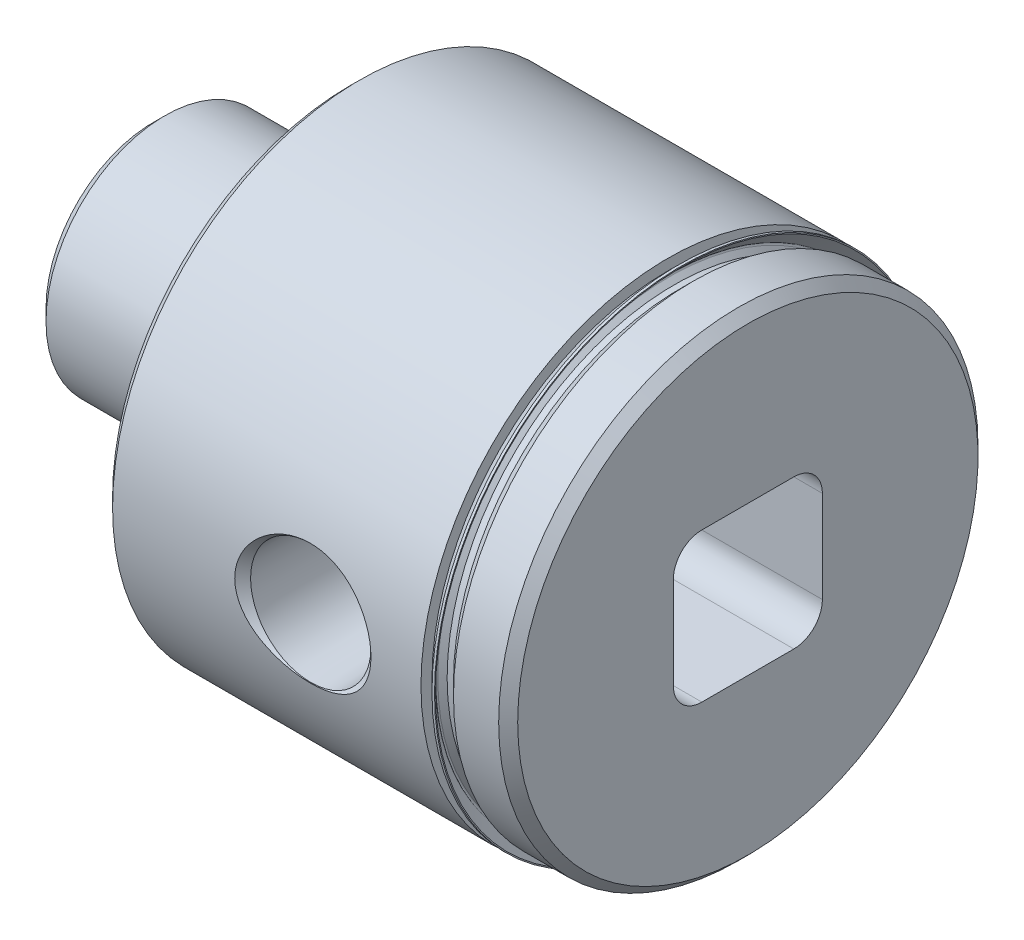
from build123d import *

# Parameters (mm, degrees)
CUT_EXTRUDE1_DEPTH = 95.25


with BuildPart() as part:
    # Sketch1 → Revolve1 (revolve)
    with BuildSketch(Plane.XY):
        with BuildLine():
            Line((0, 0), (0, 8.58901))
            Line((0, 8.58901), (0.93599, 9.525))
            Line((0.93599, 9.525), (9.344692072, 9.525))
            Line((9.344692072, 9.525), (10.348204118, 8.708440423))
            ThreePointArc((10.348204118, 8.708440423), (10.611556372, 8.560342712), (10.9093, 8.509))
            Line((10.9093, 8.509), (12.4714, 8.509))
            ThreePointArc((12.4714, 8.509), (13.100017928, 8.769382072), (13.3604, 9.398))
            Line((13.3604, 9.398), (13.3604, 9.49325))
            Line((13.3604, 9.49325), (15.748, 9.49325))
            Line((15.748, 9.49325), (15.748, 0))
            Line((15.748, 0), (0, 0))
        make_face()
    revolve(axis=Axis((15.748, 0, 0), (-1, 0, 0)))

    # Sketch2 → Revolve2 (revolve)
    with BuildSketch(Plane.XY):
        Polygon((15.748, 0), (15.748, 19.00555), (16.51, 19.76755), (41.2115, 19.76755), (41.2115, 18.18005), (42.2275, 18.18005), (43.2435, 19.19605), (46.863, 19.19605), (47.625, 18.43405), (47.625, 0), align=None)
    revolve(axis=Axis((47.625, 0, 0), (-1, 0, 0)))

    # Sketch3 → Cut-Revolve1 (revolve, cut)
    with BuildSketch(Plane(origin=(0, 0, 0), x_dir=(1, 0, 0), z_dir=(0, 1, 0))):
        Polygon((31.75, 0), (34.925, 0), (34.925, -8.330850926), (36.256425852, -9.09955), (36.569651116, -19.132537191), (37.204663925, -19.76755), (31.75, -19.76755), align=None)
    revolve(axis=Axis((31.75, 0, 19.76755), (0, 0, -1)), mode=Mode.SUBTRACT)

    # Sketch4 → Revolve3 (revolve)
    with BuildSketch(Plane.XY):
        with BuildLine():
            Line((41.2115, 17.92605), (42.2275, 17.92605))
            Line((42.2275, 17.92605), (42.2275, 18.18005))
            Line((42.2275, 18.18005), (41.7195, 18.18005))
            Line((41.7195, 18.18005), (41.344882072, 18.554667928))
            ThreePointArc((41.344882072, 18.554667928), (41.307684633, 18.64447049), (41.344882072, 18.734273051))
            Line((41.344882072, 18.734273051), (42.293990825, 19.683381804))
            Line((42.293990825, 19.683381804), (42.293990825, 19.76755))
            Line((42.293990825, 19.76755), (42.090790825, 19.76755))
            Line((42.090790825, 19.76755), (41.2115, 18.888259175))
            Line((41.2115, 18.888259175), (41.2115, 17.92605))
        make_face()
    revolve(axis=Axis((42.2275, 0, 0), (-1, 0, 0)))

    # Sketch5 → Cut-Extrude1 (cut)
    with BuildSketch(Plane(origin=(0, 0, 0), x_dir=(0, 0, -1), z_dir=(1, 0, 0))):
        with BuildLine():
            Line((-5.969, 3.683), (-5.969, -3.683))
            ThreePointArc((-5.969, -3.683), (-5.299446102, -5.299446102), (-3.683, -5.969))
            Line((-3.683, -5.969), (3.683, -5.969))
            ThreePointArc((3.683, -5.969), (5.299446102, -5.299446102), (5.969, -3.683))
            Line((5.969, -3.683), (5.969, 3.683))
            ThreePointArc((5.969, 3.683), (5.299446102, 5.299446102), (3.683, 5.969))
            Line((3.683, 5.969), (-3.683, 5.969))
            ThreePointArc((-3.683, 5.969), (-5.299446102, 5.299446102), (-5.969, 3.683))
        make_face()
    extrude(amount=CUT_EXTRUDE1_DEPTH, mode=Mode.SUBTRACT)


solid = part.part
